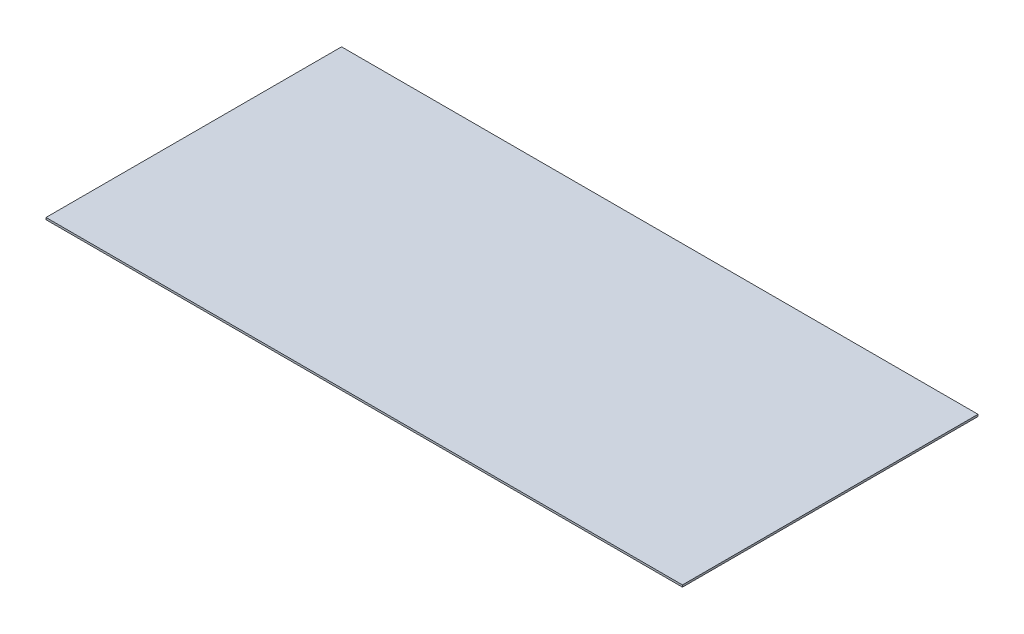
from build123d import *

# Parameters (mm, degrees)
BOSS_EXTRUDE1_DEPTH             = 2.5
BOSS_EXTRUDE1_DEPTH_BACK        = 2.5
SKETCH1_W                       = 1600.2
SKETCH1_H                       = 736.6
BOSS_EXTRUDE2_REACH             = 882.801
SKETCH2_W                       = 1612.2
SKETCH2_H                       = 748.6
SKETCH2_W_2                     = 1600.2
SKETCH2_H_2                     = 736.6
BOSS_EXTRUDE2_DIRECTION_2_REACH = 882.801


with BuildPart() as part:
    # Sketch1 → Boss-Extrude1 (new, two sides: drawn at the far end of the back side and taken through both)
    with BuildSketch(Plane(origin=(0, 0, 0), x_dir=(1, 0, 0), z_dir=(0, 1, 0)).offset(-BOSS_EXTRUDE1_DEPTH_BACK)):
        Rectangle(SKETCH1_W, SKETCH1_H)
    extrude(amount=BOSS_EXTRUDE1_DEPTH + BOSS_EXTRUDE1_DEPTH_BACK)

    # Boss-Extrude2: up to this face of the body (flat: up to its plane)
    boss_extrude2_end = Plane(part.part.faces().sort_by_distance((0, 2.5, 0))[0])
    # Sketch2 → Boss-Extrude2 (add, up to the picked face)
    with BuildSketch(Plane(origin=(0, 0, 0), x_dir=(1, 0, 0), z_dir=(0, 1, 0)), mode=Mode.PRIVATE) as boss_extrude2_sk1:
        Rectangle(SKETCH2_W, SKETCH2_H)
        Rectangle(SKETCH2_W_2, SKETCH2_H_2, mode=Mode.SUBTRACT)
    boss_extrude2_tool1 = split(extrude(boss_extrude2_sk1.sketch, amount=BOSS_EXTRUDE2_REACH, mode=Mode.PRIVATE), bisect_by=boss_extrude2_end, keep=Keep.BOTH, mode=Mode.PRIVATE)
    add(boss_extrude2_tool1.solids().sort_by(Axis((0, 0, 372.522476), (0, 1, 0)))[0])

    # Boss-Extrude2 direction 2: up to this face of the body (flat: up to its plane)
    boss_extrude2_direction_2_end = Plane(part.part.faces().sort_by_distance((0, -2.5, 0))[0])
    # Sketch2 → Boss-Extrude2 direction 2 (add, up to the picked face)
    with BuildSketch(Plane(origin=(0, 0, 0), x_dir=(1, 0, 0), z_dir=(0, 1, 0)), mode=Mode.PRIVATE) as boss_extrude2_direction_2_sk1:
        Rectangle(SKETCH2_W, SKETCH2_H)
        Rectangle(SKETCH2_W_2, SKETCH2_H_2, mode=Mode.SUBTRACT)
    boss_extrude2_direction_2_tool1 = split(extrude(boss_extrude2_direction_2_sk1.sketch, amount=-BOSS_EXTRUDE2_DIRECTION_2_REACH, mode=Mode.PRIVATE), bisect_by=boss_extrude2_direction_2_end, keep=Keep.BOTH, mode=Mode.PRIVATE)
    add(boss_extrude2_direction_2_tool1.solids().sort_by(Axis((0, 0, 372.522476), (0, -1, 0)))[0])


solid = part.part
